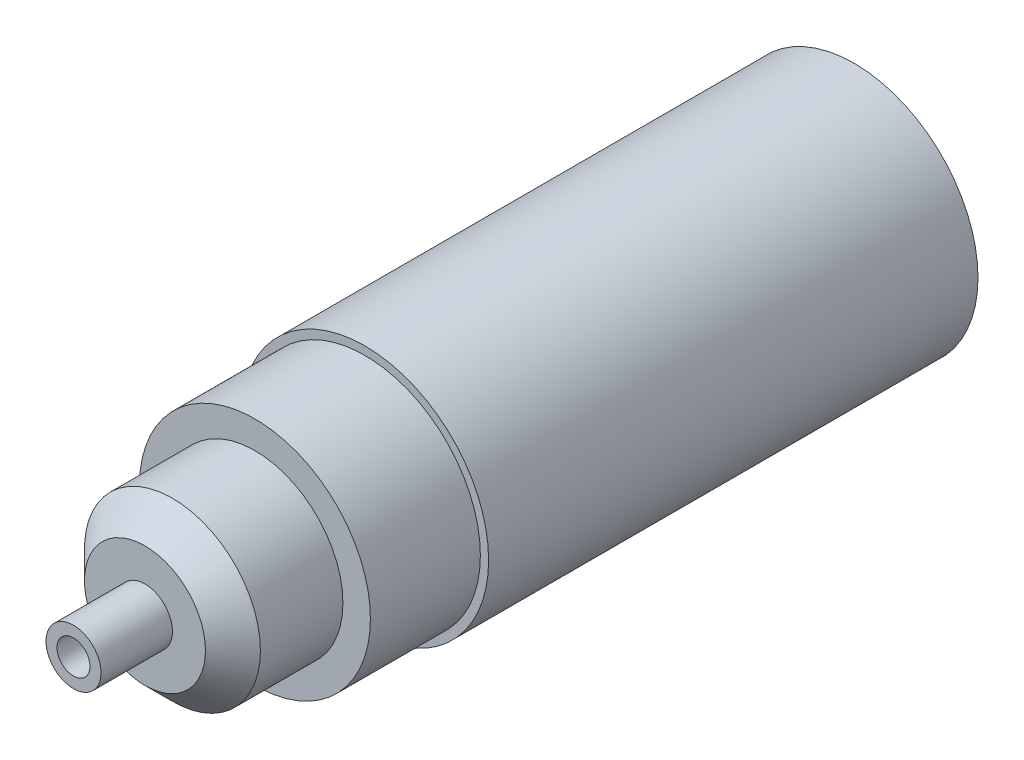
from build123d import *

# Parameters (mm, degrees)
SKETCH1_R           = 22.5
BOSS_EXTRUDE1_DEPTH = 89
SKETCH2_R           = 21
BOSS_EXTRUDE2_DEPTH = 20
SKETCH3_R           = 16
BOSS_EXTRUDE3_DEPTH = 20
CHAMFER1_SIZE       = 5
SKETCH4_R           = 5
BOSS_EXTRUDE4_DEPTH = 13
SKETCH5_R           = 3
CUT_EXTRUDE1_DEPTH  = 10


with BuildPart() as part:
    # Sketch1 → Boss-Extrude1 (new body)
    with BuildSketch(Plane.XY):
        Circle(SKETCH1_R)
    extrude(amount=BOSS_EXTRUDE1_DEPTH)

    # Sketch2 → Boss-Extrude2 (add)
    with BuildSketch(Plane.XY.offset(89)):
        Circle(SKETCH2_R)
    extrude(amount=BOSS_EXTRUDE2_DEPTH)

    # Sketch3 → Boss-Extrude3 (add)
    with BuildSketch(Plane.XY.offset(109)):
        Circle(SKETCH3_R)
    extrude(amount=BOSS_EXTRUDE3_DEPTH)

    # Chamfer1
    chamfer1_edges = [part.edges().sort_by_distance(p)[0] for p in [
        (-16, 0, 129),
    ]]
    chamfer(chamfer1_edges, length=CHAMFER1_SIZE)

    # Sketch4 → Boss-Extrude4 (add)
    with BuildSketch(Plane.XY.offset(129)):
        with Locations(Location((0, 0, 0), (0, 0, 180))):
            Circle(SKETCH4_R)
    extrude(amount=BOSS_EXTRUDE4_DEPTH)

    # Sketch5 → Cut-Extrude1 (cut)
    with BuildSketch(Plane.XY.offset(142)):
        Circle(SKETCH5_R)
    extrude(amount=-CUT_EXTRUDE1_DEPTH, mode=Mode.SUBTRACT)


solid = part.part
